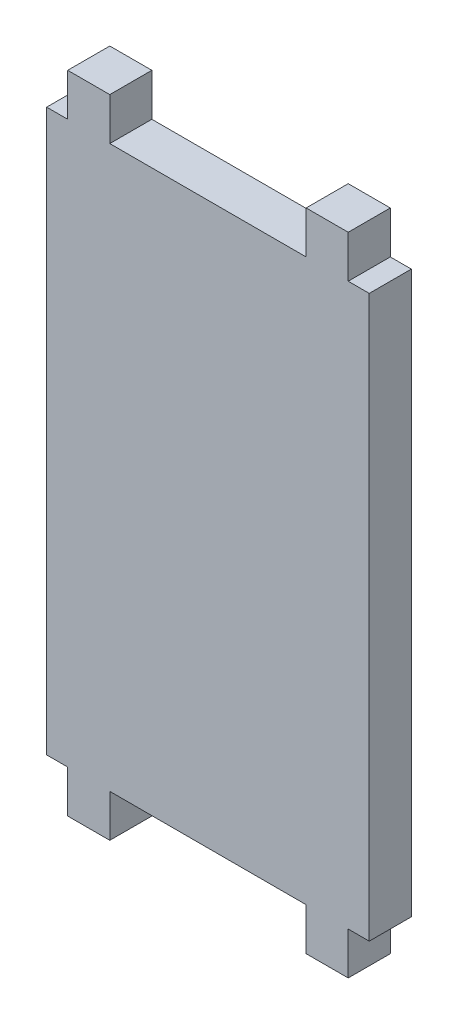
from build123d import *

# Parameters (mm, degrees)
SALIENTE_EXTRUIR1_DEPTH = 6


with BuildPart() as part:
    # Model → Saliente-Extruir1 (new body)
    with BuildSketch(Plane.XY):
        Polygon((73, 90), (73, 10), (70, 10), (70, 3.95), (64, 3.95), (64, 10), (36, 10), (36, 3.95), (30, 3.95), (30, 10), (27, 10), (27, 90), (30, 90), (30, 96.05), (36, 96.05), (36, 90), (64, 90), (64, 96.05), (70, 96.05), (70, 90), align=None)
    extrude(amount=SALIENTE_EXTRUIR1_DEPTH)


solid = part.part
